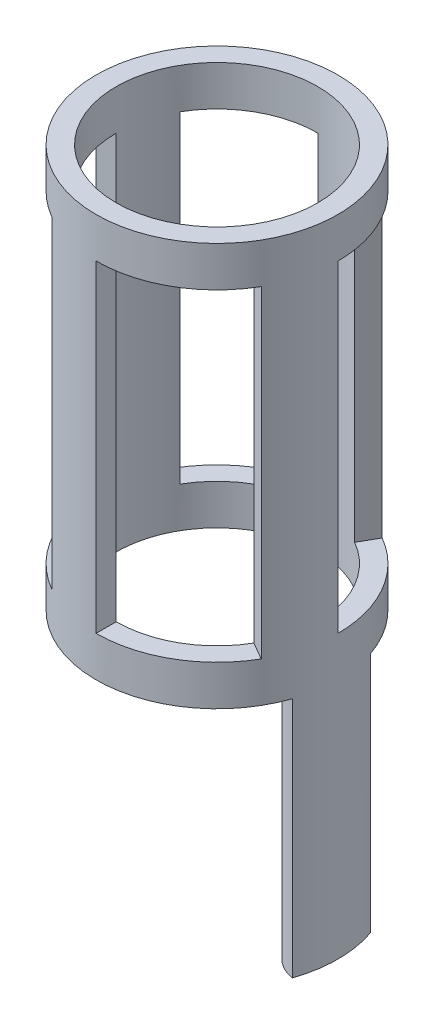
from build123d import *
from build123d.topology import SkipClean

# Parameters (mm, degrees)
SKETCH1_R           = 38.1
SKETCH1_R_2         = 31.75
BOSS_EXTRUDE1_DEPTH = 12.7
BOSS_EXTRUDE2_DEPTH = 127
BOSS_EXTRUDE3_START = -12.7
SKETCH2_R           = 38.1
SKETCH2_R_2         = 31.75
BOSS_EXTRUDE3_DEPTH = 12.7
BOSS_EXTRUDE4_START = 76.2
BOSS_EXTRUDE4_DEPTH = 76.2


with BuildPart() as part:
    # Sketch1 → Boss-Extrude1 (new body)
    with BuildSketch(Plane(origin=(0, 0, 0), x_dir=(1, 0, 0), z_dir=(0, 1, 0))):
        Circle(SKETCH1_R)
        Circle(SKETCH1_R_2, mode=Mode.SUBTRACT)
    extrude(amount=BOSS_EXTRUDE1_DEPTH)

    # Sketch1<3> → Boss-Extrude2 (add)
    with SkipClean():  # the faces are left unmerged after this step: merging them gives an invalid solid
        with BuildSketch(Plane(origin=(0, 0, 0), x_dir=(1, 0, 0), z_dir=(0, 1, 0))):
            with BuildLine():
                ThreePointArc((-19.05, -32.995567884), (-9.861005618, -36.801773982), (0, -38.1))
                Line((0, -38.1), (0, -31.75))
                ThreePointArc((0, -31.75), (-8.217504682, -30.668144985), (-15.875, -27.49630657))
                Line((-15.875, -27.49630657), (-19.05, -32.995567884))
            make_face()
            with BuildLine():
                Line((27.49630657, -15.875), (32.995567884, -19.05))
                ThreePointArc((32.995567884, -19.05), (36.801773982, -9.861005618), (38.1, 0))
                Line((38.1, 0), (31.75, 0))
                ThreePointArc((31.75, 0), (30.668144985, -8.217504682), (27.49630657, -15.875))
            make_face()
            with BuildLine():
                ThreePointArc((-32.995567884, 19.05), (-36.801773982, 9.861005618), (-38.1, 0))
                Line((-38.1, 0), (-31.75, 0))
                ThreePointArc((-31.75, 0), (-30.668144985, 8.217504682), (-27.49630657, 15.875))
                Line((-27.49630657, 15.875), (-32.995567884, 19.05))
            make_face()
            with BuildLine():
                Line((15.875, 27.49630657), (19.05, 32.995567884))
                ThreePointArc((19.05, 32.995567884), (9.861005618, 36.801773982), (0, 38.1))
                Line((0, 38.1), (0, 31.75))
                ThreePointArc((0, 31.75), (8.217504682, 30.668144985), (15.875, 27.49630657))
            make_face()
        extrude(amount=BOSS_EXTRUDE2_DEPTH)

    # Sketch2 → Boss-Extrude3 (add)
    with SkipClean():  # the faces are left unmerged after this step: merging them gives an invalid solid
        with BuildSketch(Plane(origin=(0, 127, 0), x_dir=(1, 0, 0), z_dir=(0, 1, 0)).offset(BOSS_EXTRUDE3_START)):
            Circle(SKETCH2_R)
            Circle(SKETCH2_R_2, mode=Mode.SUBTRACT)
        extrude(amount=BOSS_EXTRUDE3_DEPTH)

    # Sketch3 → Boss-Extrude4 (add)
    with SkipClean():  # the faces are left unmerged after this step: merging them gives an invalid solid
        with BuildSketch(Plane.XZ.offset(BOSS_EXTRUDE4_START)):
            with BuildLine():
                ThreePointArc((36.049475066, -12.330666953), (38.1, 0), (36.049475066, 12.330666953))
                ThreePointArc((36.049475066, 12.330666952), (25.6, 0), (36.049475066, -12.330666952))
            make_face()
            with BuildLine():
                ThreePointArc((34.369685039, 9.2781868), (35.6, 0), (34.369685039, -9.2781868))
                ThreePointArc((34.369685039, -9.2781868), (28.1, 0), (34.369685039, 9.2781868))
            make_face(mode=Mode.SUBTRACT)
        extrude(amount=-BOSS_EXTRUDE4_DEPTH)


solid = part.part
